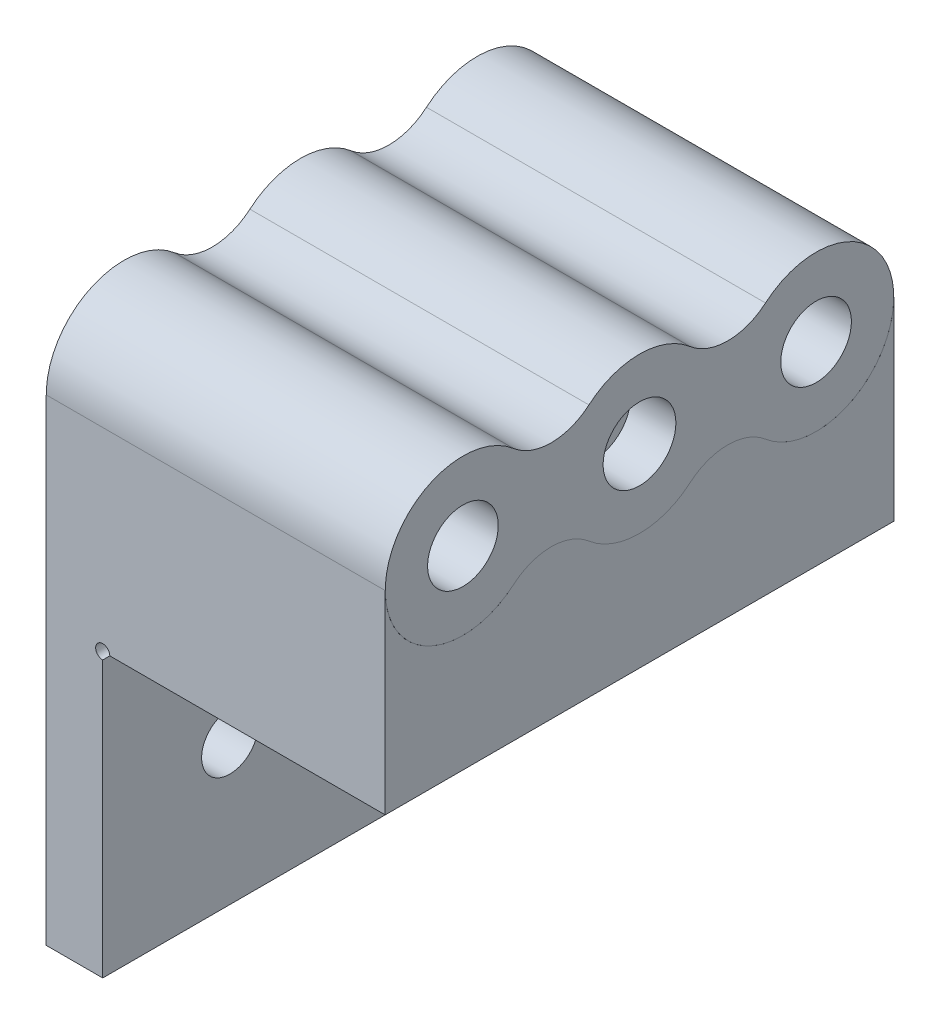
from build123d import *

# Parameters (mm, degrees)
BOSS_EXTRUDE1_DEPTH     = 18
BOSS_EXTRUDE2_DEPTH     = 24
BOSS_EXTRUDE3_DEPTH     = 24
SKETCH4_R               = 2.5
CUT_EXTRUDE1_DEPTH      = 50.402049553
SKETCH4_3_R             = 2.575
CUT_EXTRUDE2_DEPTH      = 3.2
CUT_EXTRUDE3_DEPTH      = 48.587419556
CUT_EXTRUDE3_DEPTH_BACK = 48.587419556
SKETCH6_R               = 2
SKETCH8_R               = 2
CUT_EXTRUDE4_DEPTH      = 50.402049553
SKETCH8_3_R             = 4.25
SKETCH8_3_R_2           = 2
CUT_EXTRUDE5_DEPTH      = 16.25


with BuildPart() as part:
    # Sketch1 → Boss-Extrude1 (new, symmetric)
    with BuildSketch(Plane.XY):
        with BuildLine():
            Line((0, 0), (4, 0))
            Line((4, 0), (4, 19.5))
            ThreePointArc((4, 19.5), (3.646446609, 20.353553391), (4.5, 20))
            Line((4.5, 20), (24, 20))
            Line((24, 20), (24, 24))
            Line((24, 24), (0, 24))
            Line((0, 24), (0, 0))
        make_face()
    extrude(amount=BOSS_EXTRUDE1_DEPTH, both=True)

    # Sketch9 → Boss-Extrude3 (add)
    with BuildSketch(Plane.ZY):
        with BuildLine():
            Line((-18, 24), (-18, 33.75))
            ThreePointArc((-18, 33.75), (-14.79738869, 28.752800263), (-8.919270833, 29.575269034))
            ThreePointArc((-8.919270833, 29.575269034), (-6.25, 30.56319686), (-3.580729167, 29.575269034))
            ThreePointArc((-3.580729167, 29.575269034), (0, 28.25), (3.580729167, 29.575269034))
            ThreePointArc((3.580729167, 29.575269034), (6.25, 30.56319686), (8.919270833, 29.575269034))
            ThreePointArc((8.919270833, 29.575269034), (14.79738869, 28.752800263), (18, 33.75))
            Line((18, 33.75), (18, 24))
            Line((18, 24), (-18, 24))
        make_face()
    extrude(amount=-BOSS_EXTRUDE3_DEPTH)

    # Sketch6 → Cut-Extrude3 (cut, two sides: drawn at the far end of the back side and taken through both)
    with BuildSketch(Plane(origin=(4, 0, 0), x_dir=(0, 0, -1), z_dir=(1, 0, 0)).offset(-CUT_EXTRUDE3_DEPTH_BACK)):
        with Locations((-9, 10)):
            Circle(SKETCH6_R)
        with Locations((9, 10)):
            Circle(SKETCH6_R)
    extrude(amount=CUT_EXTRUDE3_DEPTH + CUT_EXTRUDE3_DEPTH_BACK, mode=Mode.SUBTRACT)

    # Sketch8 → Cut-Extrude4 (cut, through all)
    with BuildSketch(Plane(origin=(0, 39.25, 0), x_dir=(1, 0, 0), z_dir=(0, 1, 0))):
        with Locations(Location((14, 0, 0), (0, 0, 270))):
            Circle(SKETCH8_R)
    extrude(amount=-CUT_EXTRUDE4_DEPTH, mode=Mode.SUBTRACT)

    # Sketch8<3> → Cut-Extrude5 (cut)
    with BuildSketch(Plane(origin=(0, 39.25, 0), x_dir=(1, 0, 0), z_dir=(0, 1, 0))):
        with Locations(Location((14, 0, 0), (0, 0, 270))):
            Circle(SKETCH8_3_R)
        with Locations(Location((14, 0, 0), (0, 0, 270))):
            Circle(SKETCH8_3_R_2, mode=Mode.SUBTRACT)
    extrude(amount=-CUT_EXTRUDE5_DEPTH, mode=Mode.SUBTRACT)


with BuildPart() as body_2:
    # Sketch3 → Boss-Extrude2 (new body)
    with BuildSketch(Plane.ZY.offset(-24)):
        with BuildLine():
            ThreePointArc((8.919270833, 29.575269034), (6.25, 30.56319686), (3.580729167, 29.575269034))
            ThreePointArc((3.580729167, 29.575269034), (0, 28.25), (-3.580729167, 29.575269034))
            ThreePointArc((-3.580729167, 29.575269034), (-6.25, 30.56319686), (-8.919270833, 29.575269034))
            ThreePointArc((-8.919270833, 29.575269034), (-18, 33.75), (-8.919270833, 37.924730966))
            ThreePointArc((-8.919270833, 37.924730966), (-6.25, 36.93680314), (-3.580729167, 37.924730966))
            ThreePointArc((-3.580729167, 37.924730966), (0, 39.25), (3.580729167, 37.924730966))
            ThreePointArc((3.580729167, 37.924730966), (6.25, 36.93680314), (8.919270833, 37.924730966))
            ThreePointArc((8.919270833, 37.924730966), (18, 33.75), (8.919270833, 29.575269034))
        make_face()
    extrude(amount=BOSS_EXTRUDE2_DEPTH)

    # Sketch4 → Cut-Extrude1 (cut, through all)
    with BuildSketch(Plane(origin=(24, 0, 0), x_dir=(0, 0, -1), z_dir=(1, 0, 0))):
        with Locations((-12.5, 33.75)):
            Circle(SKETCH4_R)
        with Locations((12.5, 33.75)):
            Circle(SKETCH4_R)
    extrude(amount=-CUT_EXTRUDE1_DEPTH, mode=Mode.SUBTRACT)

    # Sketch4<3> → Cut-Extrude2 (cut)
    with BuildSketch(Plane(origin=(24, 0, 0), x_dir=(0, 0, -1), z_dir=(1, 0, 0))):
        with Locations((0, 33.75)):
            Circle(SKETCH4_3_R)
    extrude(amount=-CUT_EXTRUDE2_DEPTH, mode=Mode.SUBTRACT)


solid = Compound([part.part, body_2.part])
